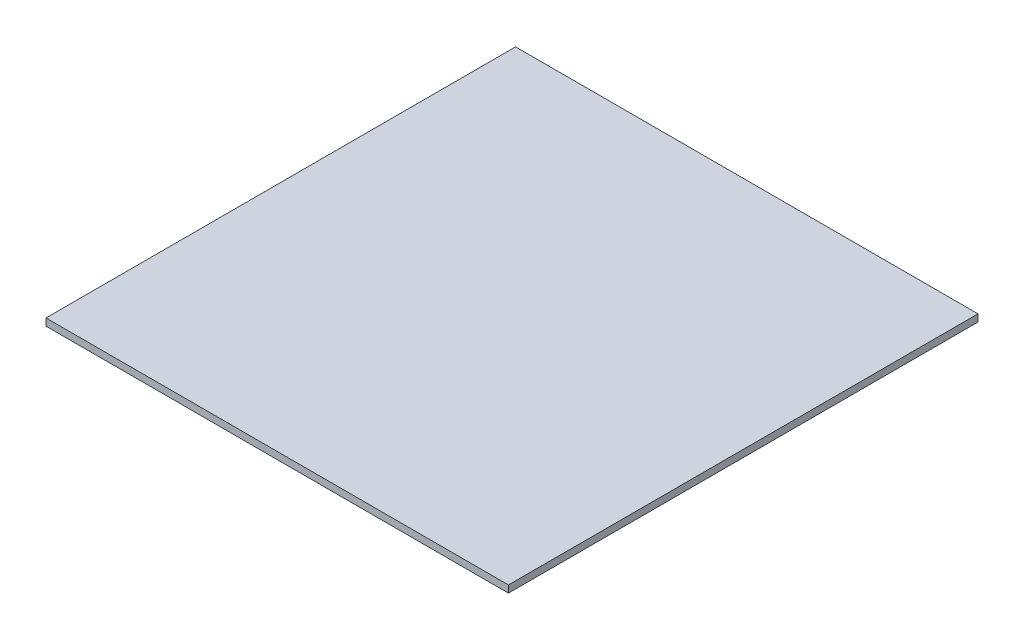
from build123d import *

# Parameters (mm, degrees)
SKETCH1_W           = 206.375
SKETCH1_H           = 209.55
BOSS_EXTRUDE1_DEPTH = 3.175


with BuildPart() as part:
    # Sketch1 → Boss-Extrude1 (new body)
    with BuildSketch(Plane(origin=(0, 0, 0), x_dir=(1, 0, 0), z_dir=(0, 1, 0))):
        Rectangle(SKETCH1_W, SKETCH1_H)
    extrude(amount=BOSS_EXTRUDE1_DEPTH)


solid = part.part
